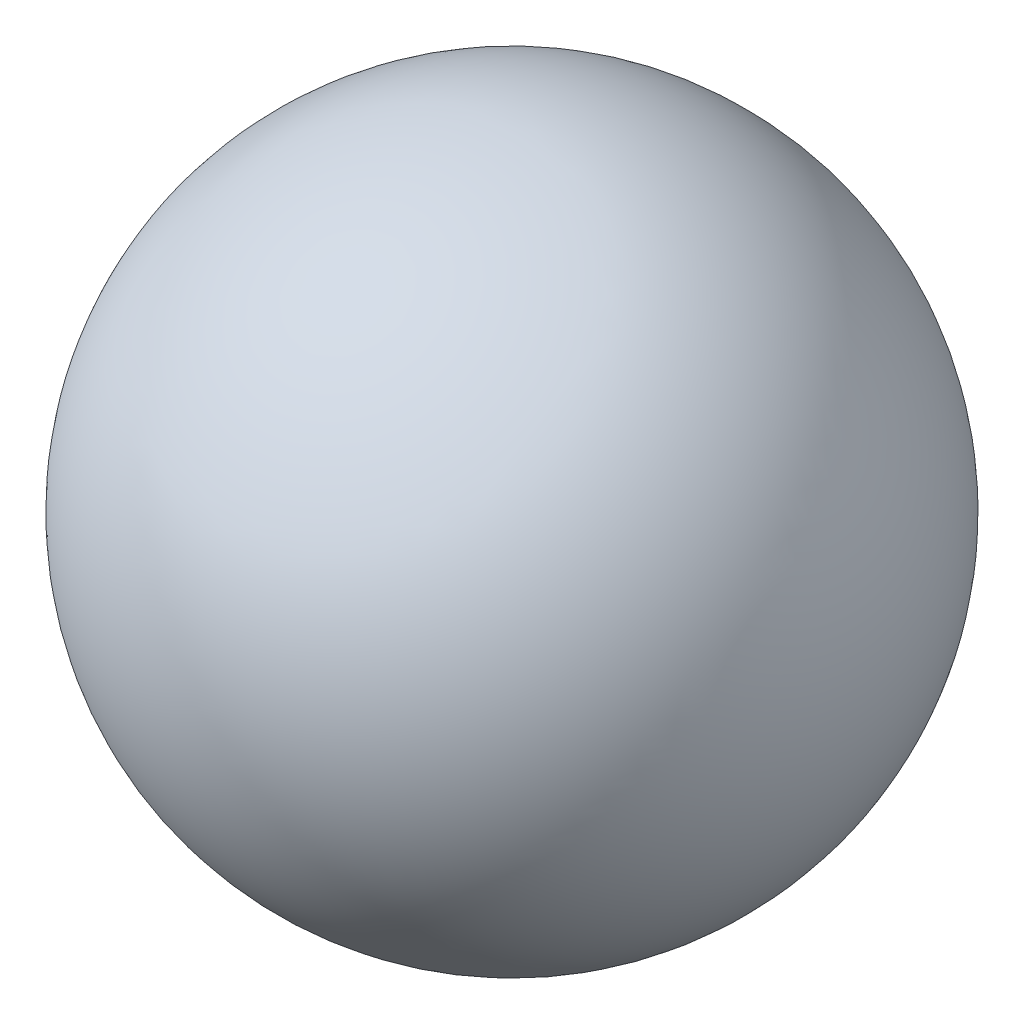
from build123d import *


with BuildPart() as part:
    # Sketch1 → Revolução1 (revolve)
    with BuildSketch(Plane.XY):
        with BuildLine():
            Line((13.1595, 19.5), (2.8405, 19.5))
            ThreePointArc((2.8405, 19.5), (8, 24.6595), (13.1595, 19.5))
        make_face()
    revolve(axis=Axis((13.1595, 19.5, 0), (-1, 0, 0)))


solid = part.part
